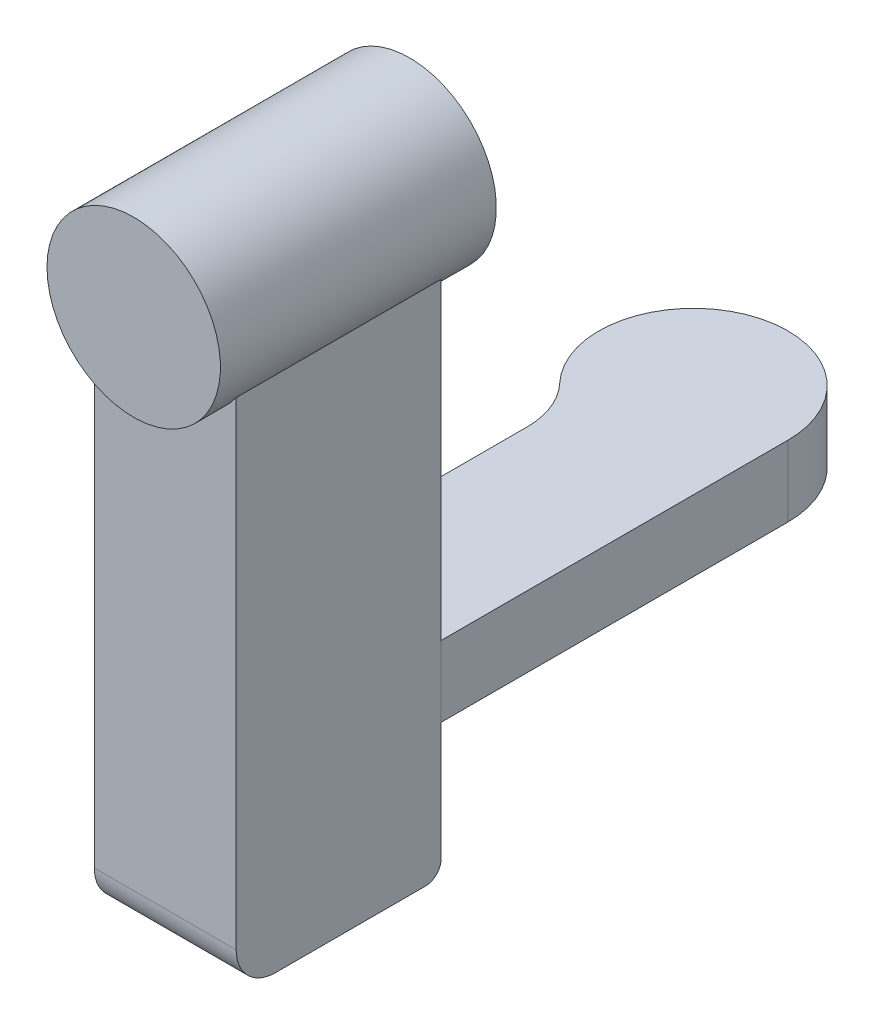
from build123d import *

# Parameters (mm, degrees)
BOSS_EXTRUDE1_DEPTH      = 9
BOSS_EXTRUDE2_DEPTH      = 40
BOSS_EXTRUDE2_DEPTH_BACK = 26
SKETCH2_W                = 18
SKETCH2_H                = 26
FILLET2_R                = 2
FILLET3_R                = 5
BOSS_EXTRUDE3_DEPTH      = 5
BOSS_EXTRUDE3_DEPTH_BACK = 30
SKETCH3_R                = 11


with BuildPart() as part:
    # Sketch1 → Boss-Extrude1 (new body)
    with BuildSketch(Plane(origin=(0, 0, 0), x_dir=(1, 0, 0), z_dir=(0, 1, 0))):
        with BuildLine():
            Line((12, 0), (12, -44))
            Line((12, -44), (-6, -44))
            Line((-6, -44), (-6, -15.099668871))
            ThreePointArc((-6, -15.099668871), (-6.706796227, -11.406924141), (-8.727272727, -8.23618302))
            ThreePointArc((-8.727272727, -8.23618302), (-4.431293675, 11.151844527), (12, 0))
        make_face()
    extrude(amount=BOSS_EXTRUDE1_DEPTH)


with BuildPart() as body_2:
    # Sketch2 → Boss-Extrude2 (new, two sides: drawn at the far end of the back side and taken through both)
    with BuildSketch(Plane(origin=(0, 9, 0), x_dir=(1, 0, 0), z_dir=(0, 1, 0)).offset(-BOSS_EXTRUDE2_DEPTH_BACK)):
        with Locations((3, -57)):
            Rectangle(SKETCH2_W, SKETCH2_H)
    extrude(amount=BOSS_EXTRUDE2_DEPTH + BOSS_EXTRUDE2_DEPTH_BACK)

    # Fillet2
    fillet2_edges = [body_2.edges().sort_by_distance(p)[0] for p in [
        (3, -17, 44),
    ]]
    fillet(fillet2_edges, radius=FILLET2_R)

    # Fillet3
    fillet3_edges = [body_2.edges().sort_by_distance(p)[0] for p in [
        (3, -17, 70),
    ]]
    fillet(fillet3_edges, radius=FILLET3_R)

    # Sketch3 → Boss-Extrude3 (add, two sides: drawn at the far end of the back side and taken through both)
    with BuildSketch(Plane(origin=(0, 0, 44), x_dir=(-1, 0, 0), z_dir=(0, 0, -1)).offset(-BOSS_EXTRUDE3_DEPTH_BACK)):
        with Locations((-3, 55)):
            Circle(SKETCH3_R)
    extrude(amount=BOSS_EXTRUDE3_DEPTH + BOSS_EXTRUDE3_DEPTH_BACK)


solid = Compound([part.part, body_2.part])
